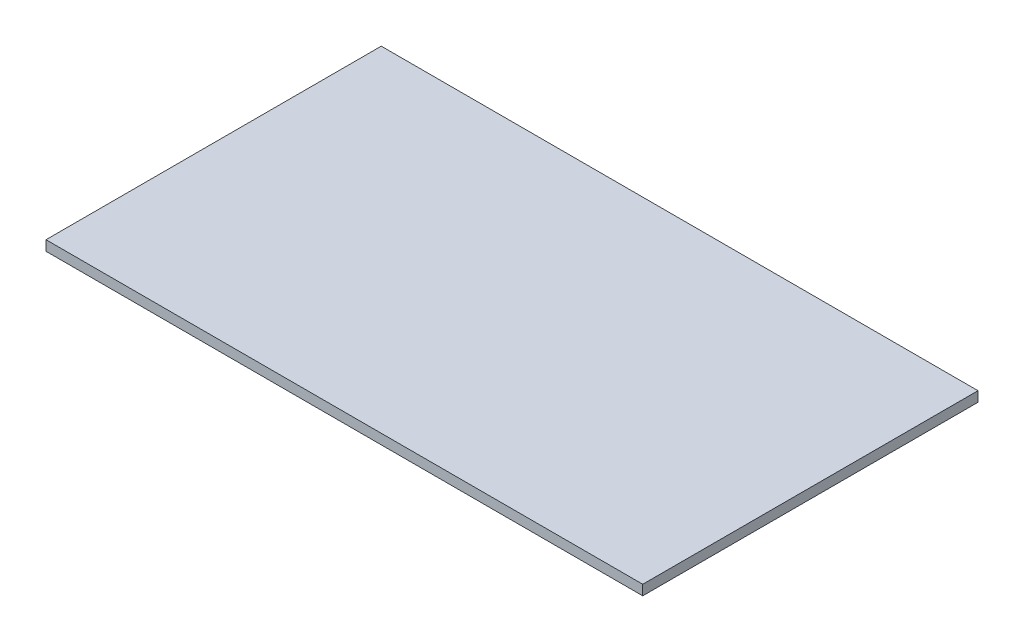
from build123d import *

# Parameters (mm, degrees)
SKETCH1_W           = 890
SKETCH1_H           = 500
BOSS_EXTRUDE1_DEPTH = 15


with BuildPart() as part:
    # Sketch1 → Boss-Extrude1 (new body)
    with BuildSketch(Plane(origin=(0, 0, 0), x_dir=(1, 0, 0), z_dir=(0, 1, 0))):
        with Locations((445, 250)):
            Rectangle(SKETCH1_W, SKETCH1_H)
    extrude(amount=BOSS_EXTRUDE1_DEPTH)


solid = part.part
